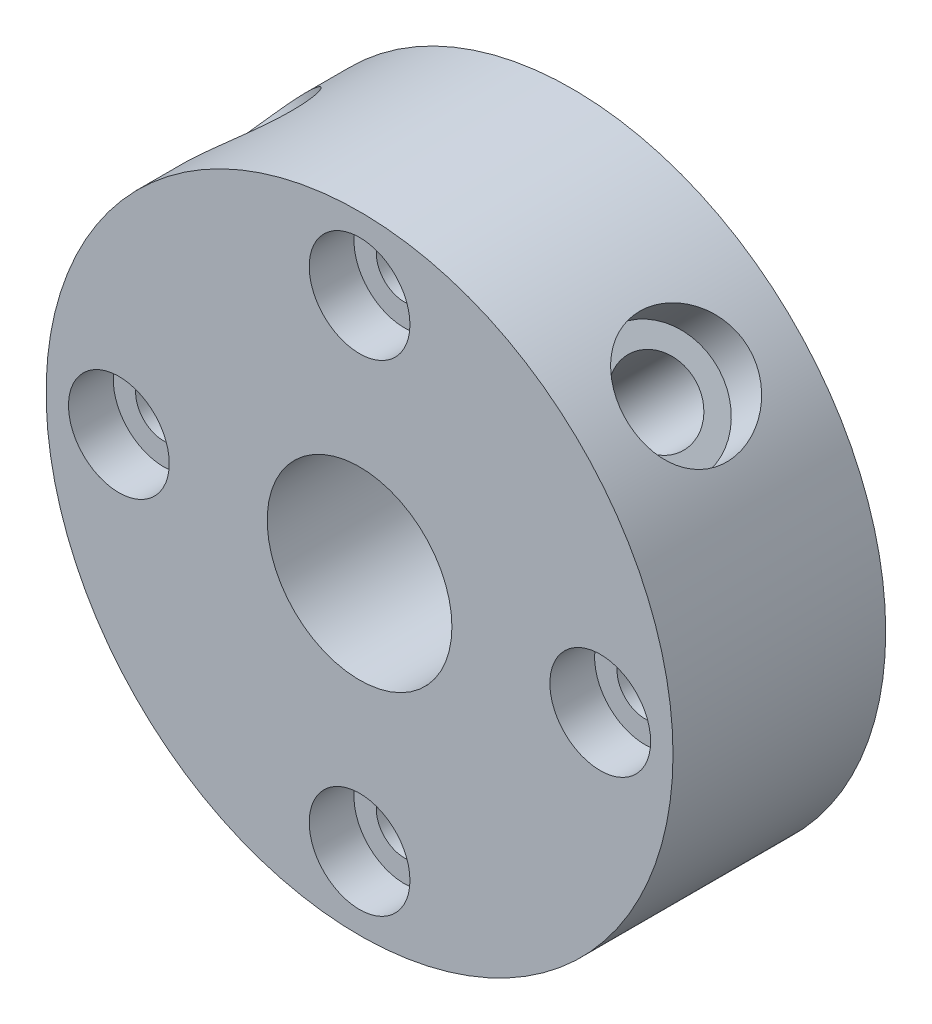
from build123d import *

# Parameters (mm, degrees)
SKETCH1_R           = 14
BOSS_EXTRUDE1_DEPTH = 2
SKETCH2_R           = 14
SKETCH2_R_2         = 4.125
BOSS_EXTRUDE2_DEPTH = 7.5
SKETCH3_R           = 5
CUT_EXTRUDE1_DEPTH  = 2
SKETCH5_R           = 1.25
CUT_EXTRUDE2_DEPTH  = 22.960191256
SKETCH7_R           = 1.75
CUT_EXTRUDE3_DEPTH  = 17
SKETCH9_R           = 1.75
CUT_EXTRUDE4_DEPTH  = 17
SKETCH10_R          = 2.25
CUT_EXTRUDE5_DEPTH  = 2
SKETCH11_R          = 2.75
CUT_EXTRUDE6_DEPTH  = 2
SKETCH12_R          = 2.75
CUT_EXTRUDE7_DEPTH  = 2


with BuildPart() as part:
    # Sketch1 → Boss-Extrude1 (new body)
    with BuildSketch(Plane.XY):
        Circle(SKETCH1_R)
    extrude(amount=BOSS_EXTRUDE1_DEPTH)

    # Sketch2 → Boss-Extrude2 (add)
    with BuildSketch(Plane.XY.offset(2)):
        Circle(SKETCH2_R)
        Circle(SKETCH2_R_2, mode=Mode.SUBTRACT)
    extrude(amount=BOSS_EXTRUDE2_DEPTH)

    # Sketch3 → Cut-Extrude1 (cut)
    with BuildSketch(Plane(origin=(0, 0, 0), x_dir=(-1, 0, 0), z_dir=(0, 0, -1))):
        Circle(SKETCH3_R)
    extrude(amount=-CUT_EXTRUDE1_DEPTH, mode=Mode.SUBTRACT)

    # Sketch5 → Cut-Extrude2 (cut, through all)
    with BuildSketch(Plane.XY.offset(9.5)):
        with Locations((0, 10.75)):
            Circle(SKETCH5_R)
        with Locations((10.75, 0)):
            Circle(SKETCH5_R)
        with Locations((0, -10.75)):
            Circle(SKETCH5_R)
        with Locations((-10.75, 0)):
            Circle(SKETCH5_R)
    extrude(amount=-CUT_EXTRUDE2_DEPTH, mode=Mode.SUBTRACT)

    # Sketch7 → Cut-Extrude3 (cut)
    with BuildSketch(Plane(origin=(9.899494937, 9.899494937, 0), x_dir=(0.7071067811865489, -0.7071067811865461, 0), z_dir=(0.7071067811865461, 0.7071067811865489, 0))):
        with Locations((0, -4.75)):
            Circle(SKETCH7_R)
    extrude(amount=-CUT_EXTRUDE3_DEPTH, mode=Mode.SUBTRACT)

    # Sketch9 → Cut-Extrude4 (cut)
    with BuildSketch(Plane(origin=(-9.899494937, 9.899494937, 0), x_dir=(0, 0, 1), z_dir=(-0.7071067811865489, 0.7071067811865462, 0))):
        with Locations((4.75, 0)):
            Circle(SKETCH9_R)
    extrude(amount=-CUT_EXTRUDE4_DEPTH, mode=Mode.SUBTRACT)

    # Sketch10 → Cut-Extrude5 (cut)
    with BuildSketch(Plane.XY.offset(9.5)):
        with Locations((0, 10.75)):
            Circle(SKETCH10_R)
        with Locations((10.75, 0)):
            Circle(SKETCH10_R)
        with Locations((0, -10.75)):
            Circle(SKETCH10_R)
        with Locations((-10.75, 0)):
            Circle(SKETCH10_R)
    extrude(amount=-CUT_EXTRUDE5_DEPTH, mode=Mode.SUBTRACT)

    # Sketch11 → Cut-Extrude6 (cut)
    with BuildSketch(Plane(origin=(9.899494937, 9.899494937, 0), x_dir=(0.7071067811865489, -0.7071067811865461, 0), z_dir=(0.7071067811865461, 0.7071067811865489, 0))):
        with Locations((0, -4.75)):
            Circle(SKETCH11_R)
    extrude(amount=-CUT_EXTRUDE6_DEPTH, mode=Mode.SUBTRACT)

    # Sketch12 → Cut-Extrude7 (cut)
    with BuildSketch(Plane(origin=(-9.899494937, 9.899494937, 0), x_dir=(0, 0, 1), z_dir=(-0.7071067811865489, 0.7071067811865462, 0))):
        with Locations((4.75, 0)):
            Circle(SKETCH12_R)
    extrude(amount=-CUT_EXTRUDE7_DEPTH, mode=Mode.SUBTRACT)


solid = part.part
